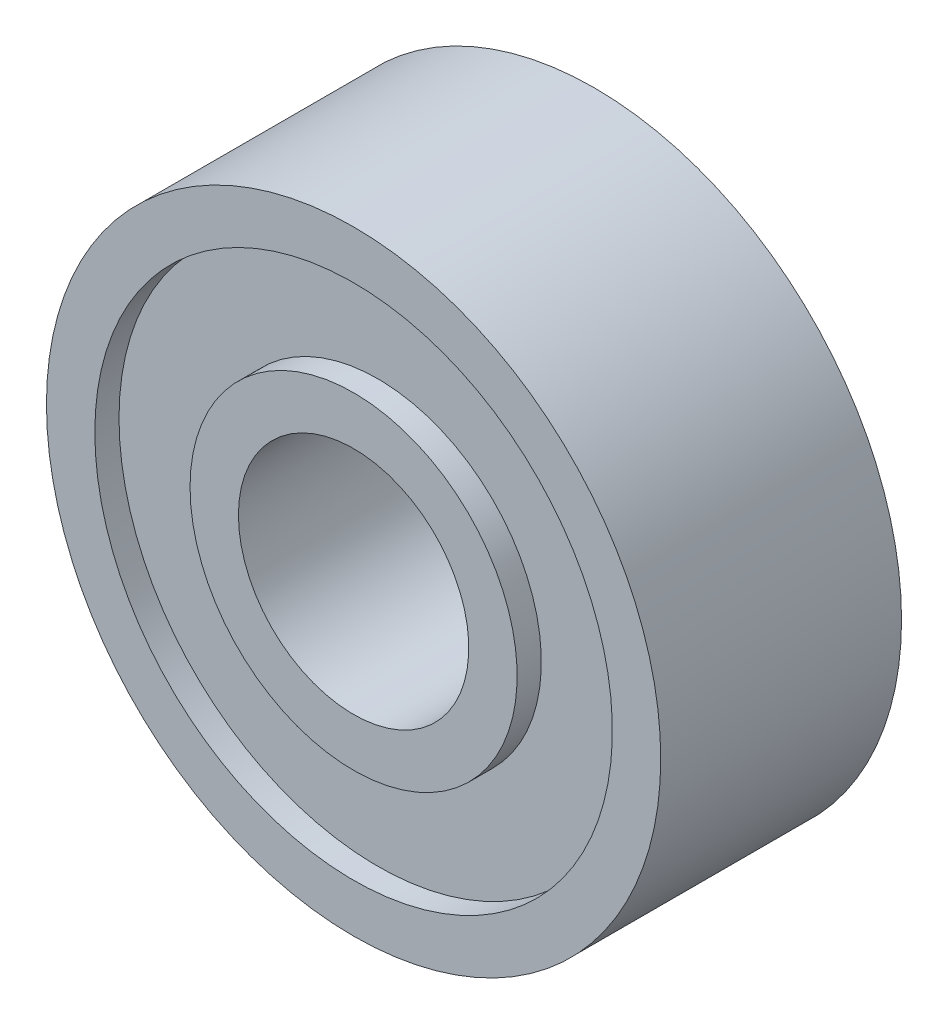
from build123d import *


with BuildPart() as part:
    # Sketch1 → Revolve1 (revolve)
    with BuildSketch(Plane.XZ, mode=Mode.PRIVATE) as revolve1_sk:
        Polygon((3.38125, 2.4892), (2.38125, 2.4892), (2.38125, -2.4892), (3.38125, -2.4892), (3.38125, -1.9892), (5.35, -1.9892), (5.35, -2.4892), (6.35, -2.4892), (6.35, 2.4892), (5.35, 2.4892), (5.35, 1.9892), (3.38125, 1.9892), align=None)
    revolve(revolve1_sk.sketch.rotate(Axis((0, 0, 2.4892), (0, 0, -1)), 180), axis=Axis((0, 0, 2.4892), (0, 0, -1)))


solid = part.part
